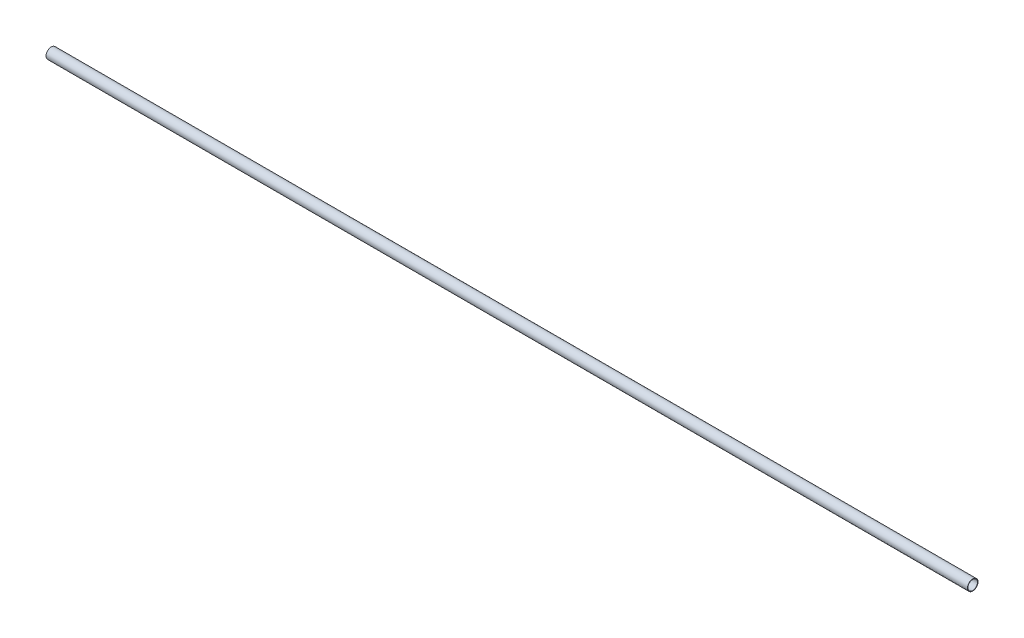
from build123d import *

# Parameters (mm, degrees)
SKETCH1_R           = 6.985
BOSS_EXTRUDE1_DEPTH = 1219.2
SKETCH2_R           = 6.35
CUT_EXTRUDE1_DEPTH  = 1220.240017572


with BuildPart() as part:
    # Sketch1 → Boss-Extrude1 (new body)
    with BuildSketch(Plane(origin=(0, 0, 0), x_dir=(0, 0, -1), z_dir=(1, 0, 0))):
        with Locations(Location((0, 0, 0), (0, 0, 180))):
            Circle(SKETCH1_R)
    extrude(amount=BOSS_EXTRUDE1_DEPTH)

    # Sketch2 → Cut-Extrude1 (cut, through all)
    with BuildSketch(Plane.ZY):
        Circle(SKETCH2_R)
    extrude(amount=-CUT_EXTRUDE1_DEPTH, mode=Mode.SUBTRACT)


solid = part.part
